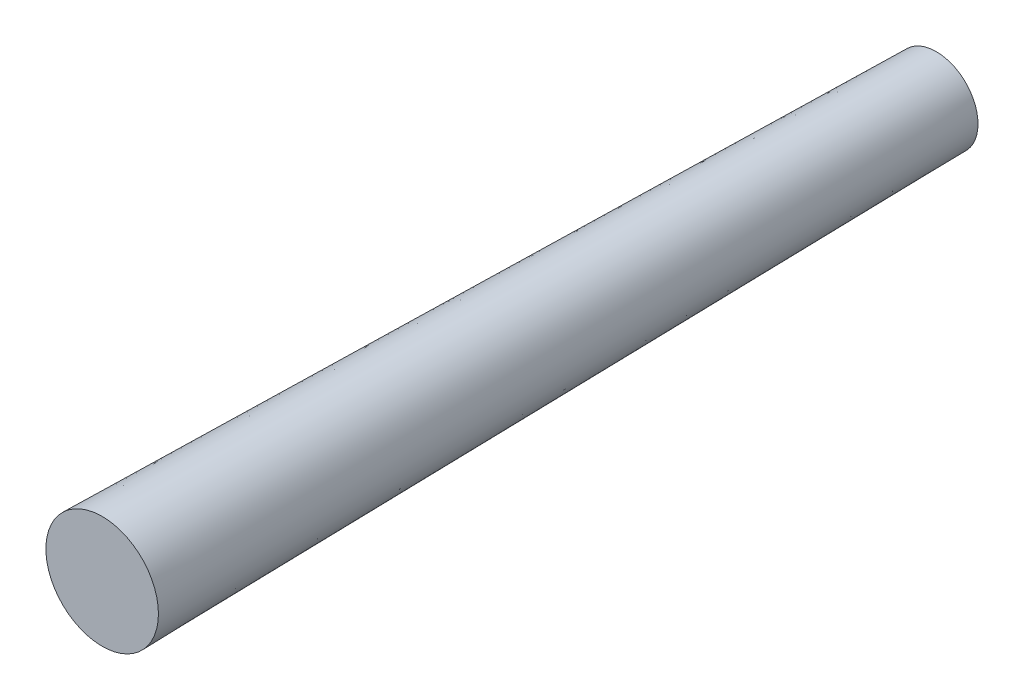
from build123d import *

# Parameters (mm, degrees)
SKETCH1_R           = 3
BOSS_EXTRUDE3_DEPTH = 60
DRAFT2_ANGLE        = 1


with BuildPart() as part:
    # Sketch1 → Boss-Extrude3 (new body)
    with BuildSketch(Plane.XY):
        Circle(SKETCH1_R)
    extrude(amount=BOSS_EXTRUDE3_DEPTH)

    # Draft2
    draft2_faces = [part.faces().sort_by_distance(p)[0] for p in [
        (-3, 0, 30),
    ]]
    draft(draft2_faces, Plane(origin=(0, 0, 0), x_dir=(-1, 0, 0), z_dir=(0, 0, -1)), DRAFT2_ANGLE)


solid = part.part
